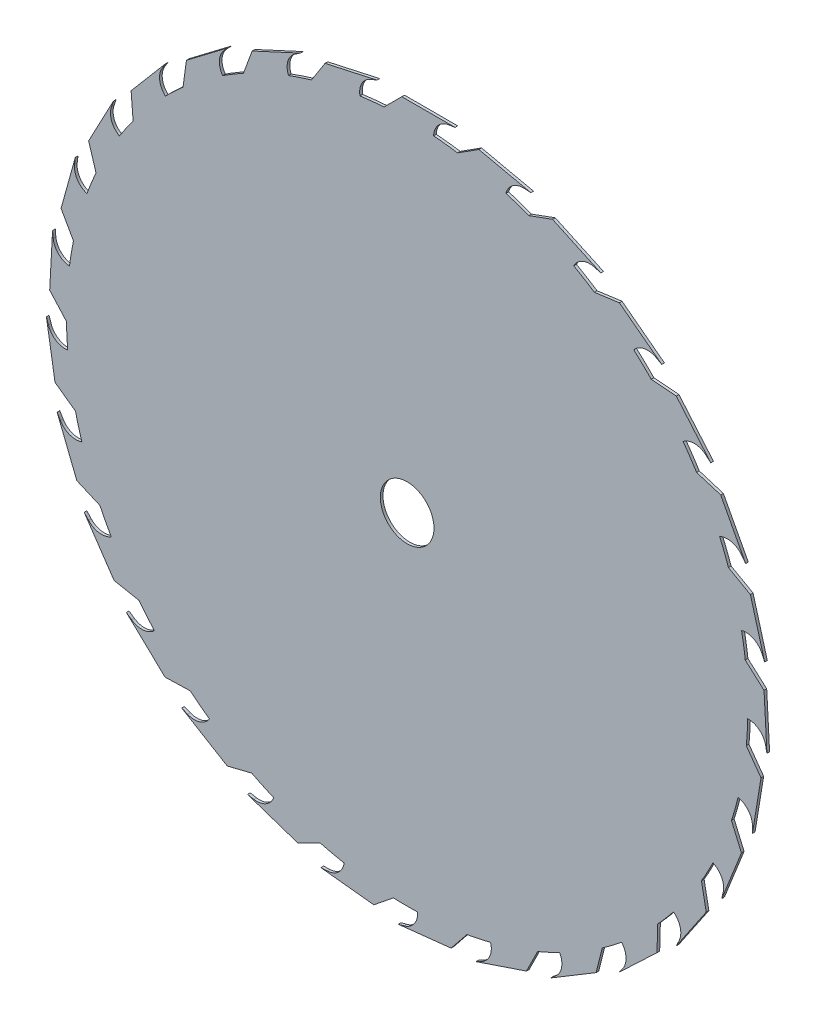
from build123d import *

# Parameters (mm, degrees)
SKETCH1_R           = 203.2
BOSS_EXTRUDE1_DEPTH = 1.5875
CUT_EXTRUDE1_REACH  = 289.373
SKETCH2_R           = 16.002
BOSS_EXTRUDE2_DEPTH = 1.5875
CIRPATTERN1_COUNT   = 29


with BuildPart() as part:
    # Sketch1 → Boss-Extrude1 (new body)
    with BuildSketch(Plane.XY):
        Circle(SKETCH1_R)
    extrude(amount=BOSS_EXTRUDE1_DEPTH)

    # Sketch2 → Cut-Extrude1 (cut, up to next)
    with BuildSketch(Plane.XY.offset(1.5875), mode=Mode.PRIVATE) as cut_extrude1_sk1:
        Circle(SKETCH2_R)
    cut_extrude1_tool1 = extrude(cut_extrude1_sk1.sketch, amount=-CUT_EXTRUDE1_REACH, mode=Mode.PRIVATE) & part.part
    add(cut_extrude1_tool1.solids().sort_by_distance((0, 0, 1.5875))[0], mode=Mode.SUBTRACT)

    # Sketch4 → Boss-Extrude2 (add)
    with BuildSketch(Plane.XY.offset(1.5875)):
        with BuildLine():
            Line((-15.875, 200.66), (-3.175, 213.36))
            Line((-3.175, 213.36), (28.575, 213.36))
            Line((28.575, 213.36), (24.808866637, 212.783511064))
            ThreePointArc((24.808866637, 212.783511064), (17.836615463, 208.567934868), (15.875, 200.66))
            Line((15.875, 200.66), (-15.875, 200.66))
        make_face()
    boss_extrude2 = extrude(amount=-BOSS_EXTRUDE2_DEPTH)

    # CirPattern1: Boss-Extrude2 ×29 about axis
    cirpattern1_axis = Axis((0, 0, 0), (0, 0, 1))
    for i in range(1, CIRPATTERN1_COUNT):
        add(boss_extrude2.rotate(cirpattern1_axis, i * 360 / CIRPATTERN1_COUNT))


solid = part.part
